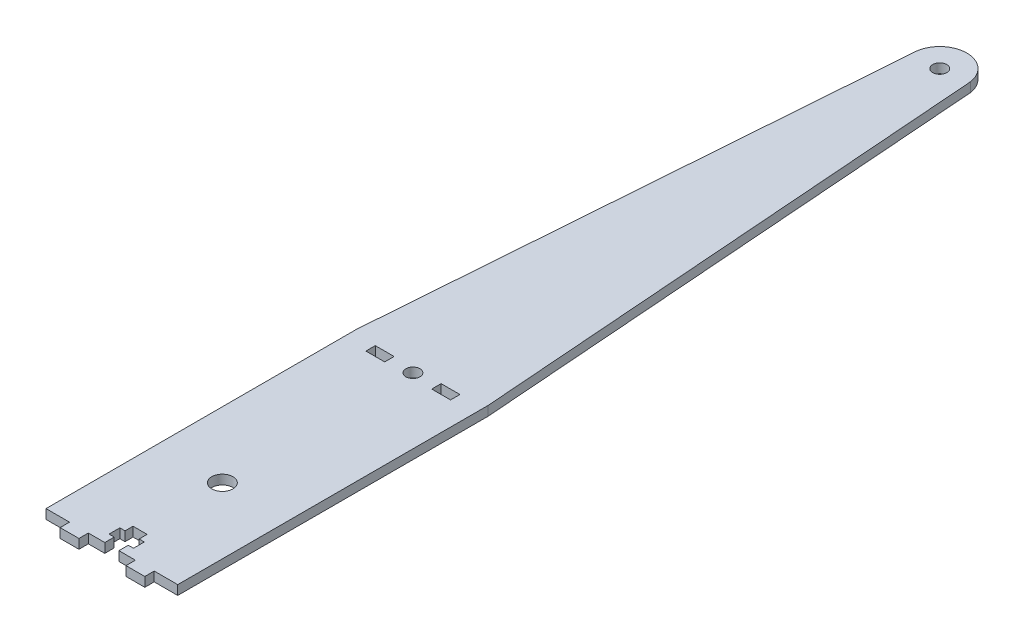
from build123d import *

# Parameters (mm, degrees)
SKETCH1_R           = 1.5
SKETCH1_R_2         = 2.25
SKETCH1_W           = 4
SKETCH1_H           = 2
BOSS_EXTRUDE1_DEPTH = 2
BOSS_EXTRUDE2_DEPTH = 2
SKETCH3_R           = 1.5
CUT_EXTRUDE1_DEPTH  = 2


with BuildPart() as part:
    # Sketch1 → Boss-Extrude1 (new body)
    with BuildSketch(Plane(origin=(0, 0, 0), x_dir=(1, 0, 0), z_dir=(0, 1, 0))):
        Polygon((0, 0), (5, 0), (5, -2), (9, -2), (9, 0), (12.5, 0), (12.5, 2), (11.4, 2), (11.4, 4.3), (12.5, 4.3), (12.5, 6), (15.5, 6), (15.5, 4.3), (16.6, 4.3), (16.6, 2), (15.5, 2), (15.5, 0), (19, 0), (19, -2), (23, -2), (23, 0), (28, 0), (28, 66), (0, 66), align=None)
        with Locations(Location((14, 64, 0), (0, 0, 270))):
            Circle(SKETCH1_R, mode=Mode.SUBTRACT)
        with Locations(Location((14, 23.49, 0), (0, 0, 270))):
            Circle(SKETCH1_R_2, mode=Mode.SUBTRACT)
        with Locations((7, 64)):
            Rectangle(SKETCH1_W, SKETCH1_H, mode=Mode.SUBTRACT)
        with Locations((21, 64)):
            Rectangle(SKETCH1_W, SKETCH1_H, mode=Mode.SUBTRACT)
    extrude(amount=BOSS_EXTRUDE1_DEPTH)

    # Sketch2 → Boss-Extrude2 (add)
    with BuildSketch(Plane(origin=(0, 2, 0), x_dir=(1, 0, 0), z_dir=(0, 1, 0))):
        with BuildLine():
            Line((28, 66), (0, 66))
            Line((0, 66), (9, 186))
            ThreePointArc((9, 186), (14, 191), (19, 186))
            Line((19, 186), (28, 66))
        make_face()
    extrude(amount=-BOSS_EXTRUDE2_DEPTH)

    # Sketch3 → Cut-Extrude1 (cut)
    with BuildSketch(Plane(origin=(0, 2, 0), x_dir=(1, 0, 0), z_dir=(0, 1, 0))):
        with Locations(Location((14, 176, 0), (0, 0, 270))):
            Circle(SKETCH3_R)
        with BuildLine():
            Line((19.75, 176), (22.006411719, 176))
            Line((22.006411719, 176), (22.006411719, 202.106155701))
            Line((22.006411719, 202.106155701), (5.130827786, 202.106155701))
            Line((5.130827786, 202.106155701), (5.130827786, 176))
            Line((5.130827786, 176), (8.25, 176))
            ThreePointArc((8.25, 176), (14, 181.75), (19.75, 176))
        make_face()
    extrude(amount=-CUT_EXTRUDE1_DEPTH, mode=Mode.SUBTRACT)


solid = part.part
